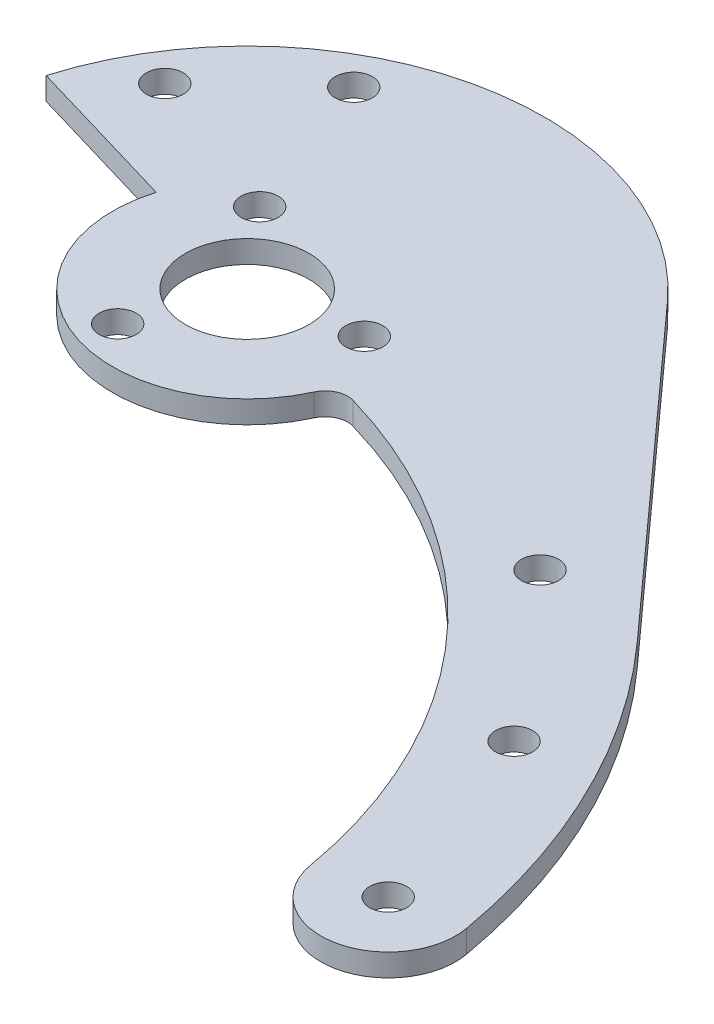
from build123d import *

# Parameters (mm, degrees)
SKETCH_1_R         = 1.65
SKETCH_1_R_2       = 5.5
EXTRUDE_2450_DEPTH = 2
FILLET_1_R         = 2


with BuildPart() as part:
    # Эскиз1 → Extrude 2450 (new body)
    with BuildSketch(Plane(origin=(0, 0, 0), x_dir=(1, 0, 0), z_dir=(0, 1, 0))):
        with BuildLine():
            Line((-11.508257905, 3.4), (-25.414069539, 7.508333333))
            ThreePointArc((-25.414069539, 7.508333333), (-18.086736192, 19.368014197), (-5.754049101, 25.86775829))
            ThreePointArc((-5.754049101, 25.86775829), (8.055154344, 25.246078676), (19.6725691, 17.755))
            Line((19.6725691, 17.755), (44.541665887, -9.8))
            ThreePointArc((44.541665887, -9.8), (53.912240119, -23.666174502), (59.088465181, -39.58110934))
            ThreePointArc((59.088465181, -39.58110934), (54.221507729, -46.531844924), (47.270772145, -41.664887472))
            ThreePointArc((47.270772145, -41.664887472), (35.068418794, -17.224917951), (11.508257905, -3.4))
            ThreePointArc((11.508257905, -3.4), (-3.4, -11.508257905), (-11.508257905, 3.4))
        make_face()
        with Locations(Location((-5.785088487, 6.894399988, 0), (0, 0, 270))):
            Circle(SKETCH_1_R, mode=Mode.SUBTRACT)
        with Locations(Location((8.863269777, 1.562833599, 0), (0, 0, 270))):
            Circle(SKETCH_1_R, mode=Mode.SUBTRACT)
        with Locations(Location((0, 0, 0), (0, 0, 270))):
            Circle(SKETCH_1_R_2, mode=Mode.SUBTRACT)
        with Locations(Location((-3.07818129, -8.457233587, 0), (0, 0, 270))):
            Circle(SKETCH_1_R, mode=Mode.SUBTRACT)
        with Locations(Location((-19.513769828, 12.174267415, 0), (0, 0, 270))):
            Circle(SKETCH_1_R, mode=Mode.SUBTRACT)
        with Locations(Location((-10.812286687, 20.300109768, 0), (0, 0, 90))):
            Circle(SKETCH_1_R, mode=Mode.SUBTRACT)
        with Locations(Location((53.179618663, -40.622998406, 0), (0, 0, 270))):
            Circle(SKETCH_1_R, mode=Mode.SUBTRACT)
        with Locations(Location((46.765371804, -23, 0), (0, 0, 270))):
            Circle(SKETCH_1_R, mode=Mode.SUBTRACT)
        with Locations(Location((34.710530923, -8.633600072, 0), (0, 0, 270))):
            Circle(SKETCH_1_R, mode=Mode.SUBTRACT)
    extrude(amount=EXTRUDE_2450_DEPTH)

    # Скругление1
    fillet_1_edges = [part.edges().sort_by_distance(p)[0] for p in [
        (11.508257905, 1, 3.4),
    ]]
    fillet(fillet_1_edges, radius=FILLET_1_R)


solid = part.part
